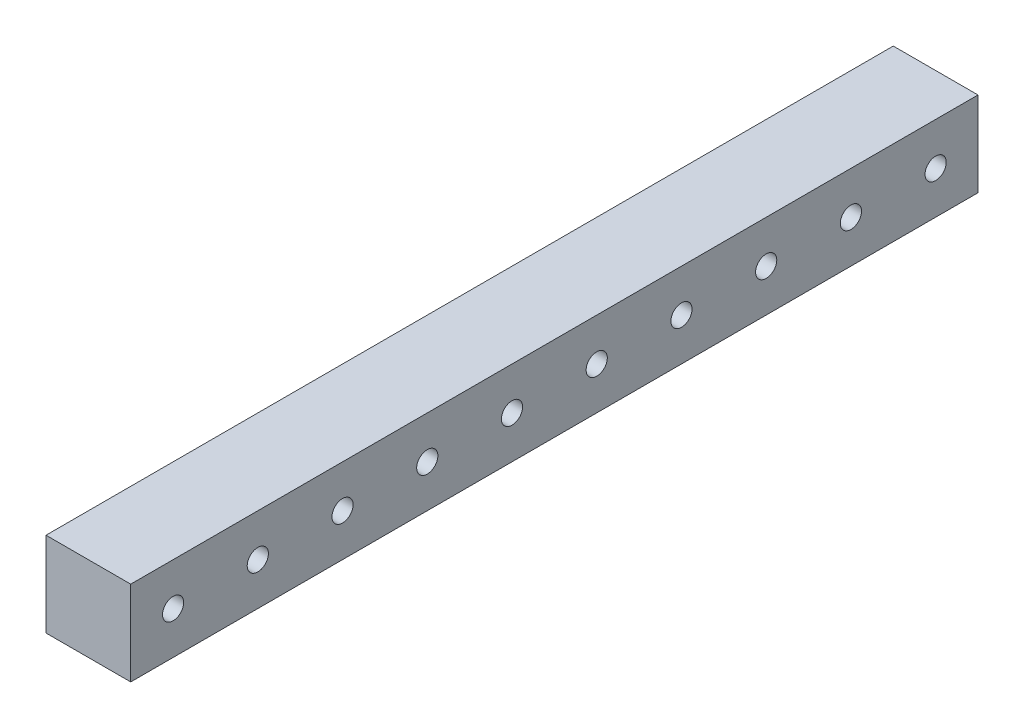
from build123d import *

# Parameters (mm, degrees)
SKETCH1_W             = 20
SKETCH1_H             = 20
BOSS_EXTRUDE1_DEPTH   = 200
F_5_0MM_DOWEL_HOLE1_D = 5
LPATTERN2_COUNT       = 10
LPATTERN2_PITCH       = 20


with BuildPart() as part:
    # Sketch1 → Boss-Extrude1 (new body)
    with BuildSketch(Plane.XY):
        Rectangle(SKETCH1_W, SKETCH1_H)
    extrude(amount=BOSS_EXTRUDE1_DEPTH)

    # Ø5.0mm Dowel Hole1 (through all)
    with Locations(Plane(origin=(10, 0, 0), x_dir=(0, 0, -1), z_dir=(1, 0, 0))):
        with Locations((-10, 0)):
            f_5_0mm_dowel_hole1 = Hole(F_5_0MM_DOWEL_HOLE1_D / 2)

    # LPattern2: Ø5.0mm Dowel Hole1 ×10
    with Locations(*[(0, 0, i * LPATTERN2_PITCH) for i in range(1, LPATTERN2_COUNT)]):
        add(f_5_0mm_dowel_hole1, mode=Mode.SUBTRACT)


solid = part.part
